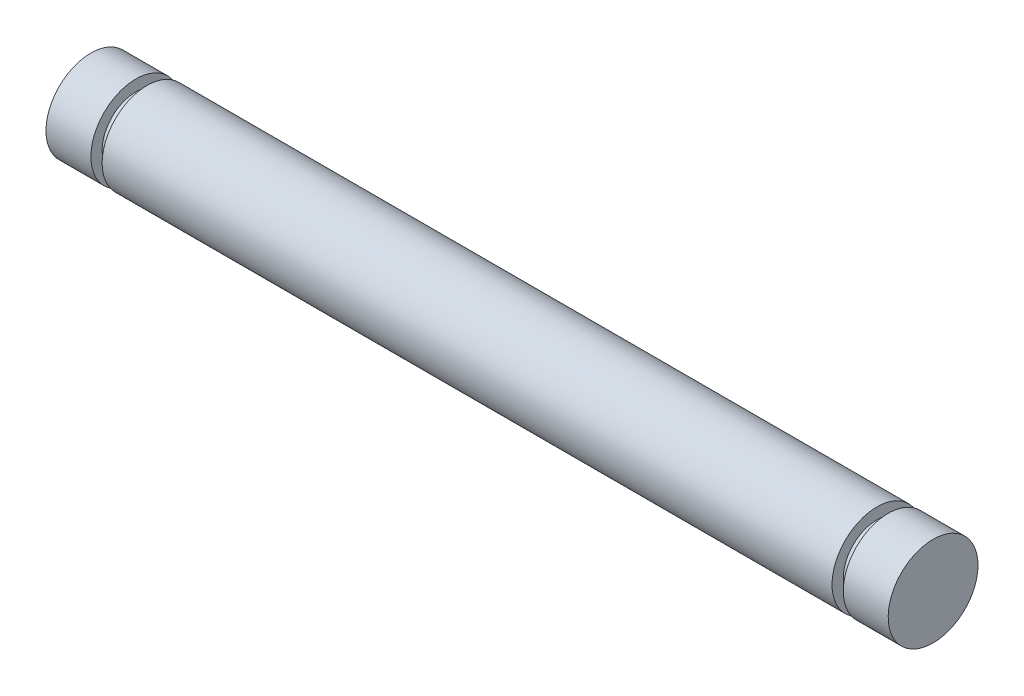
from build123d import *


with BuildPart() as part:
    # Croquis1 → Revolución1 (revolve)
    with BuildSketch(Plane.XY, mode=Mode.PRIVATE) as revoluci_n1_sk:
        Polygon((-37.5, 0), (-37.5, 4), (-33.5, 4), (-33.5, 3), (-32.5, 3), (-32.5, 4), (32.5, 4), (32.5, 3), (33.5, 3), (33.5, 4), (37.5, 4), (37.5, 0), align=None)
    revolve(revoluci_n1_sk.sketch.rotate(Axis((-37.5, 0, 0), (1, 0, 0)), 180), axis=Axis((-37.5, 0, 0), (1, 0, 0)))


solid = part.part
